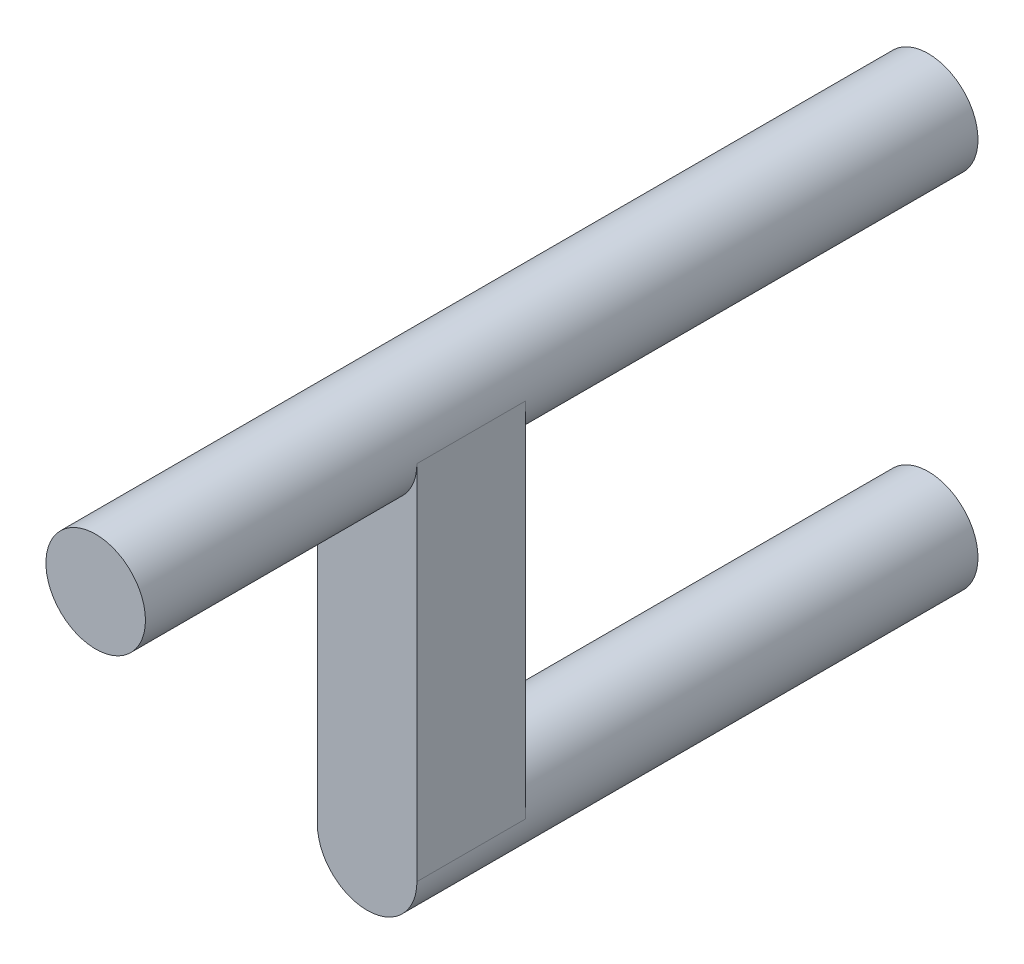
from build123d import *

# Parameters (mm, degrees)
BOSS_EXTRUDE11_DEPTH = 116.84
BOSS_EXTRUDE12_DEPTH = 63.5
SKETCH19_W           = 13.97
SKETCH19_H           = 50.8
BOSS_EXTRUDE13_DEPTH = 15.24
SKETCH21_R           = 6.985
BOSS_EXTRUDE15_DEPTH = 15.24


with BuildPart() as part:
    # Sketch2 → Boss-Extrude11 (new body)
    with BuildSketch(Plane.XY):
        with BuildLine():
            ThreePointArc((6.985, 0), (-4.939140867, 4.939140867), (0, -6.985))
            ThreePointArc((0, -6.985), (4.939140867, -4.939140867), (6.985, 0))
        make_face()
    extrude(amount=BOSS_EXTRUDE11_DEPTH)



with BuildPart() as body_2:
    # Sketch2<4> → Boss-Extrude12 (new body)
    with BuildSketch(Plane.XY):
        with BuildLine():
            ThreePointArc((6.985, -50.8), (4.939140867, -45.860859133), (0, -43.815))
            ThreePointArc((0, -43.815), (-4.939140867, -55.739140867), (6.985, -50.8))
        make_face()
    extrude(amount=BOSS_EXTRUDE12_DEPTH)


with BuildPart() as part_1:
    add(part.part)

    add(body_2.part)  # Boss-Extrude13 merges body 2
    # Sketch19 → Boss-Extrude13 (add)
    with BuildSketch(Plane.XY.offset(63.5)):
        with Locations((0, -25.4)):
            Rectangle(SKETCH19_W, SKETCH19_H)
    extrude(amount=BOSS_EXTRUDE13_DEPTH)

    # Sketch21 → Boss-Extrude15 (add)
    with BuildSketch(Plane.XY.offset(63.5)):
        with Locations((0, -50.8)):
            Circle(SKETCH21_R)
    extrude(amount=BOSS_EXTRUDE15_DEPTH)


solid = part_1.part
